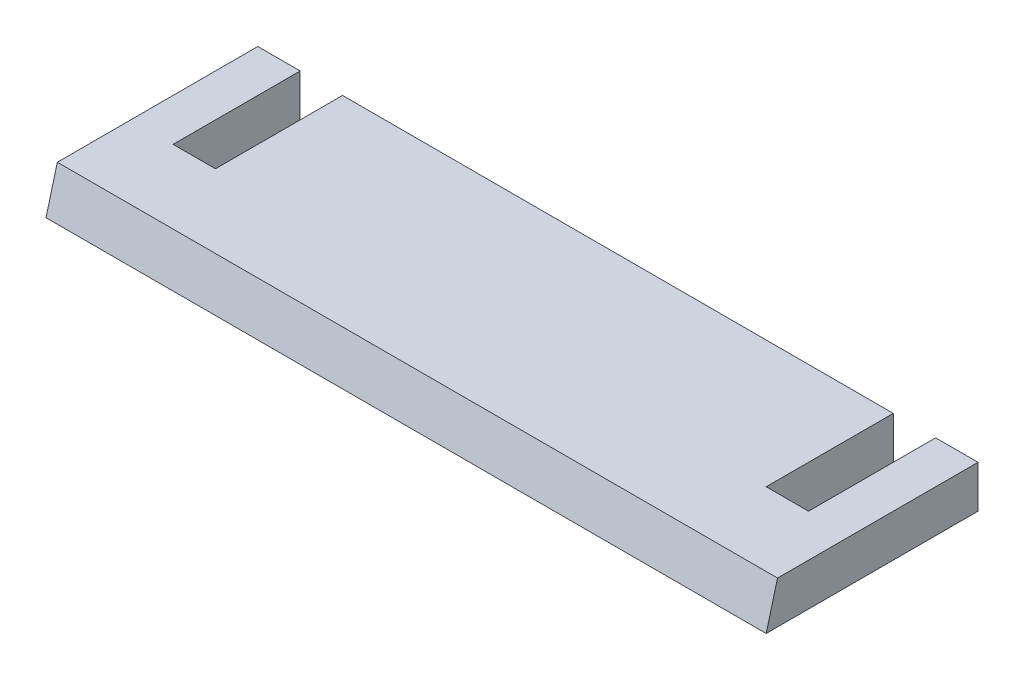
from build123d import *

# Parameters (mm, degrees)
BOSS_EXTRUDE1_DEPTH = 10
DRAFT1_ANGLE        = -15


with BuildPart() as part:
    # Sketch1 → Boss-Extrude1 (new body)
    with BuildSketch(Plane(origin=(0, 0, 0), x_dir=(1, 0, 0), z_dir=(0, 1, 0))):
        Polygon((0, 0), (0, 50), (10, 50), (10, 20), (20, 20), (20, 50), (150, 50), (150, 20), (160, 20), (160, 50), (170, 50), (170, 0), align=None)
    extrude(amount=BOSS_EXTRUDE1_DEPTH)

    # Draft1
    draft1_faces = [part.faces().sort_by_distance(p)[0] for p in [
        (85, 5, 0),
    ]]
    draft(draft1_faces, Plane(origin=(0, 0, 0), x_dir=(0, 0, -1), z_dir=(0, -1, 0)), DRAFT1_ANGLE)


solid = part.part
